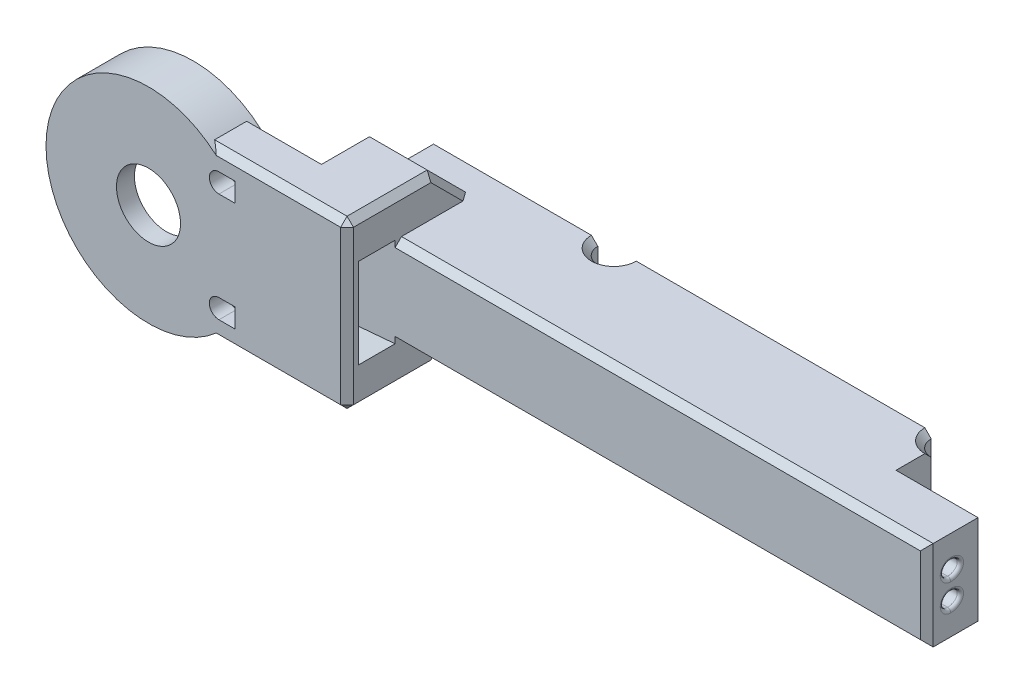
from build123d import *

# Parameters (mm, degrees)
SKETCH1_R            = 2.5
BOSS_EXTRUDE1_DEPTH  = 3.5
CUT_EXTRUDE17_DEPTH  = 2.1
BOSS_EXTRUDE11_DEPTH = 5
BOSS_EXTRUDE4_DEPTH  = 42
SKETCH7_W            = 8.9
SKETCH7_H            = 13
CUT_EXTRUDE2_DEPTH   = 4
SKETCH22_W           = 41.5
SKETCH22_H           = 13
CUT_EXTRUDE13_DEPTH  = 3.75
SKETCH23_W           = 41.5
SKETCH23_H           = 8
CUT_EXTRUDE14_DEPTH  = 3
CUT_EXTRUDE11_DEPTH  = 67.008048752
BOSS_EXTRUDE12_DEPTH = 7
SKETCH24_R           = 1.25
CUT_EXTRUDE15_DEPTH  = 59.730848053
SKETCH26_W           = 4.3
SKETCH26_H           = 4.75
CUT_EXTRUDE16_DEPTH  = 1.65
FILLET8_R            = 0.25
CHAMFER1_SIZE        = 0.5


with BuildPart() as part:
    # Sketch1 → Boss-Extrude1 (new body)
    with BuildSketch(Plane.XY):
        with BuildLine():
            ThreePointArc((4.663689527, 6.5), (-8, 0), (4.663689527, -6.5))
            Line((4.663689527, -6.5), (15, -6.5))
            Line((15, -6.5), (15, 6.5))
            Line((15, 6.5), (4.663689527, 6.5))
        make_face()
        with BuildLine():
            Line((5.5, 5), (6.75, 5))
            Line((6.75, 5), (6.75, 3.5))
            Line((6.75, 3.5), (5.5, 3.5))
            ThreePointArc((5.5, 3.5), (4.75, 4.25), (5.5, 5))
        make_face(mode=Mode.SUBTRACT)
        with BuildLine():
            Line((6.75, -3.5), (6.75, -5))
            Line((6.75, -5), (5.5, -5))
            ThreePointArc((5.5, -5), (4.75, -4.25), (5.5, -3.5))
            Line((5.5, -3.5), (6.75, -3.5))
        make_face(mode=Mode.SUBTRACT)
        Circle(SKETCH1_R, mode=Mode.SUBTRACT)
    extrude(amount=BOSS_EXTRUDE1_DEPTH)

    # Sketch39 → Cut-Extrude17 (cut)
    with BuildSketch(Plane(origin=(0, 0, 0), x_dir=(-1, 0, 0), z_dir=(0, 0, -1))):
        Polygon((5.75, 0.75), (5.75, 2.5), (2.5, 5.75), (-6.75, 5.75), (-6.75, -5.75), (2.5, -5.75), (5.75, -2.5), (5.75, -0.75), (8.376697216, -0.75), (8.376697216, 0.75), align=None)
    extrude(amount=-CUT_EXTRUDE17_DEPTH, mode=Mode.SUBTRACT)

    # Sketch38 → Boss-Extrude11 (add)
    with BuildSketch(Plane(origin=(15, 0, 0), x_dir=(0, 0, -1), z_dir=(1, 0, 0))):
        Polygon((-3.5, 6.5), (3.25, 6.5), (6.25, 3.5), (8.25, 3.5), (8.25, -3.5), (6.25, -3.5), (3.25, -6.5), (-3.5, -6.5), align=None)
    extrude(amount=-BOSS_EXTRUDE11_DEPTH)

    # Sketch6 → Boss-Extrude4 (add)
    with BuildSketch(Plane(origin=(15, 0, 0), x_dir=(0, 0, -1), z_dir=(1, 0, 0))):
        Polygon((6.25, 3.5), (3.25, 6.5), (-3.5, 6.5), (-3.5, -6.5), (3.25, -6.5), (6.25, -3.5), (8.25, -3.5), (8.25, 3.5), align=None)
    extrude(amount=BOSS_EXTRUDE4_DEPTH)

    # Sketch7 → Cut-Extrude2 (cut)
    with BuildSketch(Plane(origin=(0, 0, -8.25), x_dir=(-1, 0, 0), z_dir=(0, 0, -1))):
        with Locations((-52.55, 0)):
            Rectangle(SKETCH7_W, SKETCH7_H)
    extrude(amount=-CUT_EXTRUDE2_DEPTH, mode=Mode.SUBTRACT)

    # Sketch22 → Cut-Extrude13 (cut)
    with BuildSketch(Plane.XY.offset(3.5)):
        with Locations((36.25, 0)):
            Rectangle(SKETCH22_W, SKETCH22_H)
    extrude(amount=-CUT_EXTRUDE13_DEPTH, mode=Mode.SUBTRACT)

    # Sketch23 → Cut-Extrude14 (cut)
    with BuildSketch(Plane(origin=(0, 6.5, 0), x_dir=(1, 0, 0), z_dir=(0, 1, 0))):
        with Locations((36.25, 4.25)):
            Rectangle(SKETCH23_W, SKETCH23_H)
    cut_extrude14 = extrude(amount=-CUT_EXTRUDE14_DEPTH, mode=Mode.SUBTRACT)

    # Mirror1: Cut-Extrude14 across plane
    add(cut_extrude14.mirror(Plane.ZX), mode=Mode.SUBTRACT)

    # Sketch19 → Cut-Extrude11 (cut, through all)
    with BuildSketch(Plane(origin=(57, 0, 0), x_dir=(0, 0, -1), z_dir=(1, 0, 0))):
        with BuildLine():
            ThreePointArc((2.125, -0.475), (1.55, -1.05), (2.125, -1.625))
            add(Edge.make_bspline(
                [(2.125, -1.625), (2.875, -1.625), (2.875, -1.05), (2.875, -0.475), (2.125, -0.475)],
                knots=[4.71238898, 4.71238898, 4.71238898, 6.283185307, 6.283185307, 7.853981634, 7.853981634, 7.853981634], degree=2, weights=[1, 0.707106781, 1, 0.707106781, 1]))
        make_face()
        with BuildLine():
            ThreePointArc((2.125, 1.625), (1.55, 1.05), (2.125, 0.475))
            add(Edge.make_bspline(
                [(2.125, 0.475), (2.875, 0.475), (2.875, 1.05), (2.875, 1.625), (2.125, 1.625)],
                knots=[4.71238898, 4.71238898, 4.71238898, 6.283185307, 6.283185307, 7.853981634, 7.853981634, 7.853981634], degree=2, weights=[1, 0.707106781, 1, 0.707106781, 1]))
        make_face()
    extrude(amount=-CUT_EXTRUDE11_DEPTH, mode=Mode.SUBTRACT)

    # Sketch25 → Boss-Extrude12 (add)
    with BuildSketch(Plane(origin=(0, 3.5, 0), x_dir=(1, 0, 0), z_dir=(0, 1, 0))):
        with BuildLine():
            Line((48.1, 4.25), (50.6, 4.25))
            Line((50.6, 4.25), (50.6, 7))
            ThreePointArc((50.6, 7), (49.716116524, 7.366116524), (49.35, 8.25))
            Line((49.35, 8.25), (48.1, 8.25))
            Line((48.1, 8.25), (48.1, 4.25))
        make_face()
    extrude(amount=-BOSS_EXTRUDE12_DEPTH)

    # Sketch24 → Cut-Extrude15 (cut, through all)
    with BuildSketch(Plane(origin=(0, 3.5, 0), x_dir=(1, 0, 0), z_dir=(0, 1, 0))):
        with Locations((24.575, 8.25)):
            Circle(SKETCH24_R)
    extrude(amount=-CUT_EXTRUDE15_DEPTH, mode=Mode.SUBTRACT)

    # Sketch26 → Cut-Extrude16 (cut)
    with BuildSketch(Plane(origin=(0, -3.5, 0), x_dir=(1, 0, 0), z_dir=(0, 1, 0))):
        with Locations((35.25, 5.875)):
            Rectangle(SKETCH26_W, SKETCH26_H)
    extrude(amount=CUT_EXTRUDE16_DEPTH, mode=Mode.SUBTRACT)

    # Fillet8
    fillet8_edges = [part.edges().sort_by_distance(p)[0] for p in [
        (10, 1.05, -1.55),
        (10, 1.05, -2.875),
        (10, -1.05, -1.55),
        (10, -1.05, -2.875),
        (57, -1.05, -2.875),
        (57, -1.05, -1.55),
        (57, 1.05, -2.875),
        (57, 1.05, -1.55),
    ]]
    fillet(fillet8_edges, radius=FILLET8_R)

    # Sketch41 → Cut-Loft1 section 0
    with BuildSketch(Plane.ZY.offset(-6.75)):
        with BuildLine():
            Line((2.1, -4.25), (-0.25, -4.25))
            Line((-0.25, -4.25), (-0.25, 4.25))
            Line((-0.25, 4.25), (2.1, 4.25))
            Line((2.1, 4.25), (2.1, -4.25))
        make_face()
    # Sketch40 → Cut-Loft1 section 1
    with BuildSketch(Plane(origin=(15.5, 0, 0), x_dir=(0, 0, -1), z_dir=(1, 0, 0))):
        with BuildLine():
            Line((-2.1, 3.5), (0.25, 3.5))
            Line((0.25, 3.5), (0.25, -3.5))
            Line((0.25, -3.5), (-2.1, -3.5))
            Line((-2.1, -3.5), (-2.1, 3.5))
        make_face()
    loft(mode=Mode.SUBTRACT)

    # Chamfer1
    chamfer1_edges = [part.edges().sort_by_distance(p)[0] for p in [
        (10, 6.5, -1.625),
        (10, 5, -4.75),
        (10, 3.5, -7.25),
        (10, 0, -8.25),
        (10, -3.5, -7.25),
        (10, -5, -4.75),
        (10, -6.5, -1.625),
        (15.5, 0, 2.1),
        (15.5, -5, -4.75),
        (15.5, 5, -4.75),
        (15.5, 6.5, 0.125),
        (15.5, 0, 3.5),
        (15.5, -6.5, 0.125),
        (36.25, 3.5, -0.25),
        (57, 0, -0.25),
        (36.25, -3.5, -0.25),
        (33.1, -3.5, -5.875),
        (35.25, -3.5, -3.5),
        (37.4, -3.5, -5.875),
        (49.716116524, -3.5, -7.366116524),
        (49.716116524, 3.5, -7.366116524),
        (24.575, 3.5, -7),
        (24.575, -3.5, -7),
        (7.331844763, -6.5, 0),
        (7.331844763, 6.5, 0),
        (10.081844763, -6.5, 3.5),
        (10.081844763, 6.5, 3.5),
    ]]
    chamfer(chamfer1_edges, length=CHAMFER1_SIZE)


solid = part.part
